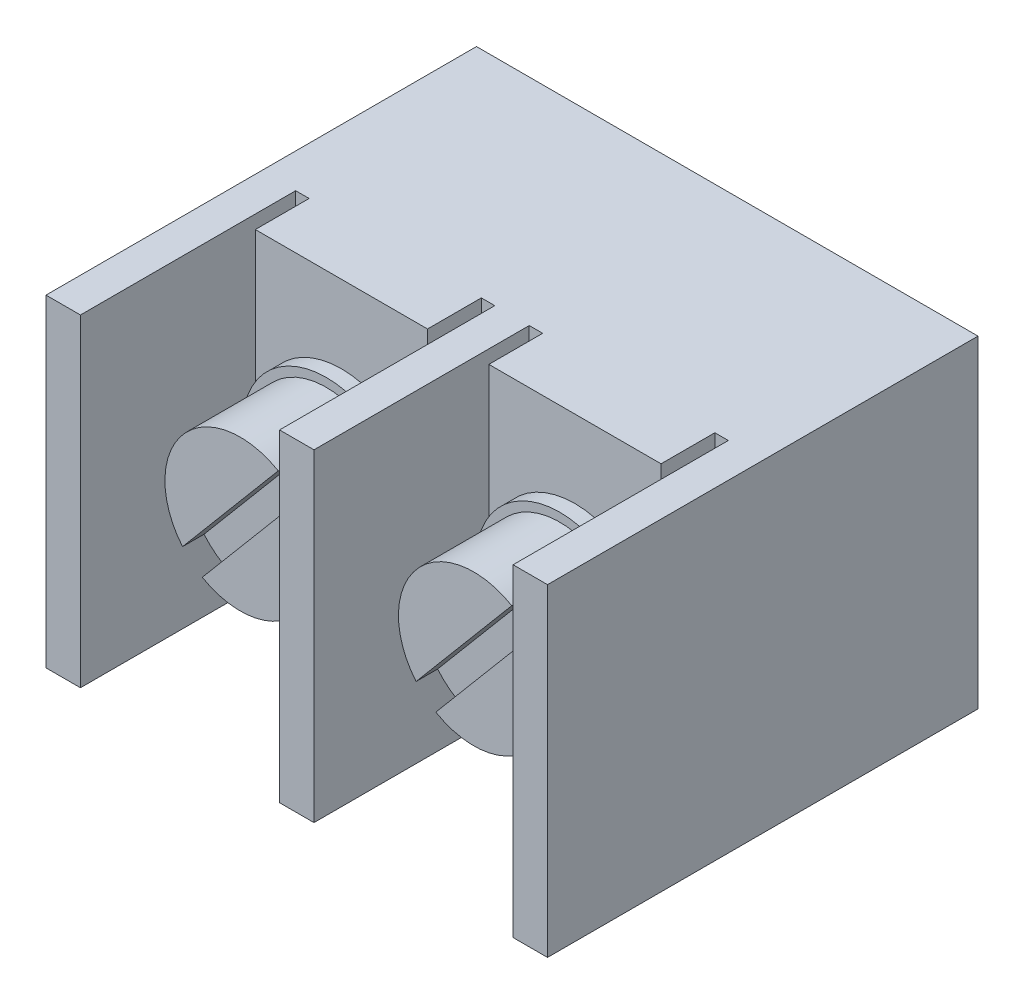
from build123d import *

# Parameters (mm, degrees)
SKETCH_1_W          = 45
SKETCH_1_H          = 15
EXTRUDE_1_DEPTH     = 10
SKETCH_2_W          = 1.6
SKETCH_2_H          = 15
EXTRUDE_2_DEPTH     = 10
SKETCH_3_W          = 8
SKETCH_3_H          = 15
EXTRUDE_3_DEPTH     = 2.5
SKETCH_4_R          = 3.9
EXTRUDE_4_DEPTH     = 0.7
SKETCH_6_R          = 3.5
EXTRUDE_5_DEPTH     = 4
CUT_EXTRUDE_START   = -1
CUT_EXTRUDE_1_DEPTH = 1
SKETCH_8_R          = 0.85
EXTRUDE_6_DEPTH     = 2.5
SKETCH_10_W         = 26.424079993
SKETCH_10_H         = 19.841794199
CUT_EXTRUDE_2_DEPTH = 21.7


with BuildPart() as part:
    # Эскиз1 → Вытянуть1 (new body)
    with BuildSketch(Plane.XY):
        Rectangle(SKETCH_1_W, SKETCH_1_H)
    extrude(amount=EXTRUDE_1_DEPTH)

    # Эскиз2 → Вытянуть2 (add)
    with BuildSketch(Plane.XY.offset(10)):
        with Locations((-21.7, 0)):
            Rectangle(SKETCH_2_W, SKETCH_2_H)
        with Locations((-10.85, 0)):
            Rectangle(SKETCH_2_W, SKETCH_2_H)
        Rectangle(SKETCH_2_W, SKETCH_2_H)
        with Locations((10.85, 0)):
            Rectangle(SKETCH_2_W, SKETCH_2_H)
        with Locations((21.7, 0)):
            Rectangle(SKETCH_2_W, SKETCH_2_H)
    extrude(amount=EXTRUDE_2_DEPTH)

    # Эскиз3 → Вытянуть3 (add)
    with BuildSketch(Plane.XY.offset(10)):
        with Locations((-16.275, 0)):
            Rectangle(SKETCH_3_W, SKETCH_3_H)
        with Locations((-5.425, 0)):
            Rectangle(SKETCH_3_W, SKETCH_3_H)
        with Locations((5.425, 0)):
            Rectangle(SKETCH_3_W, SKETCH_3_H)
        with Locations((16.275, 0)):
            Rectangle(SKETCH_3_W, SKETCH_3_H)
    extrude(amount=EXTRUDE_3_DEPTH)

    # Эскиз4 → Вытянуть4 (add)
    with BuildSketch(Plane.XY.offset(12.5)):
        with Locations(Location((-16.275, 0, 0), (0, 0, 180))):
            Circle(SKETCH_4_R)
        with Locations(Location((-5.425, 0, 0), (0, 0, 180))):
            Circle(SKETCH_4_R)
        with Locations(Location((5.425, 0, 0), (0, 0, 180))):
            Circle(SKETCH_4_R)
        with Locations(Location((16.275, 0, 0), (0, 0, 180))):
            Circle(SKETCH_4_R)
    extrude(amount=EXTRUDE_4_DEPTH)

    # Эскиз6 → Вытянуть5 (add)
    with BuildSketch(Plane.XY.offset(13.2)):
        with Locations((-16.275, 0)):
            Circle(SKETCH_6_R)
        with Locations((-5.425, 0)):
            Circle(SKETCH_6_R)
        with Locations((5.425, 0)):
            Circle(SKETCH_6_R)
        with Locations((16.275, 0)):
            Circle(SKETCH_6_R)
    extrude(amount=EXTRUDE_5_DEPTH)

    # Эскиз7 → Вырез-Вытянуть1 (cut)
    with BuildSketch(Plane.XY.offset(17.2).offset(CUT_EXTRUDE_START)):
        with BuildLine():
            Line((-14.510977508, 3.02294966), (-18.956438169, -2.24941978))
            ThreePointArc((-18.956438169, -2.24941978), (-18.531128818, -2.675795724), (-18.039022492, -3.02294966))
            Line((-18.039022492, -3.02294966), (-13.593561831, 2.24941978))
            ThreePointArc((-13.593561831, 2.24941978), (-14.018871182, 2.675795724), (-14.510977508, 3.02294966))
        make_face()
        with BuildLine():
            Line((-3.660977508, 3.02294966), (-8.106438169, -2.24941978))
            ThreePointArc((-8.106438169, -2.24941978), (-7.681128818, -2.675795724), (-7.189022492, -3.02294966))
            Line((-7.189022492, -3.02294966), (-2.743561831, 2.24941978))
            ThreePointArc((-2.743561831, 2.24941978), (-3.168871182, 2.675795724), (-3.660977508, 3.02294966))
        make_face()
        with BuildLine():
            Line((7.189022492, 3.02294966), (2.743561831, -2.24941978))
            ThreePointArc((2.743561831, -2.24941978), (3.168871182, -2.675795724), (3.660977508, -3.02294966))
            Line((3.660977508, -3.02294966), (8.106438169, 2.24941978))
            ThreePointArc((8.106438169, 2.24941978), (7.681128818, 2.675795724), (7.189022492, 3.02294966))
        make_face()
        with BuildLine():
            Line((18.039022492, 3.02294966), (13.593561831, -2.24941978))
            ThreePointArc((13.593561831, -2.24941978), (14.018871182, -2.675795724), (14.510977508, -3.02294966))
            Line((14.510977508, -3.02294966), (18.956438169, 2.24941978))
            ThreePointArc((18.956438169, 2.24941978), (18.531128818, 2.675795724), (18.039022492, 3.02294966))
        make_face()
    extrude(amount=CUT_EXTRUDE_1_DEPTH, mode=Mode.SUBTRACT)

    # Эскиз8 → Вытянуть6 (add)
    with BuildSketch(Plane(origin=(0, 0, 0), x_dir=(-1, 0, 0), z_dir=(0, 0, -1))):
        with Locations((-5, 0)):
            Circle(SKETCH_8_R)
        with Locations((5, 0)):
            Circle(SKETCH_8_R)
        with Locations((15, 0)):
            Circle(SKETCH_8_R)
        with Locations((-15, 0)):
            Circle(SKETCH_8_R)
    extrude(amount=EXTRUDE_6_DEPTH)

    # Эскиз10 → Вырез-Вытянуть2 (cut)
    with BuildSketch(Plane(origin=(22.5, 0, 0), x_dir=(0, 0, -1), z_dir=(1, 0, 0))):
        with Locations((-8.639252884, 0.348101652)):
            Rectangle(SKETCH_10_W, SKETCH_10_H)
    extrude(amount=-CUT_EXTRUDE_2_DEPTH, mode=Mode.SUBTRACT)


solid = part.part
